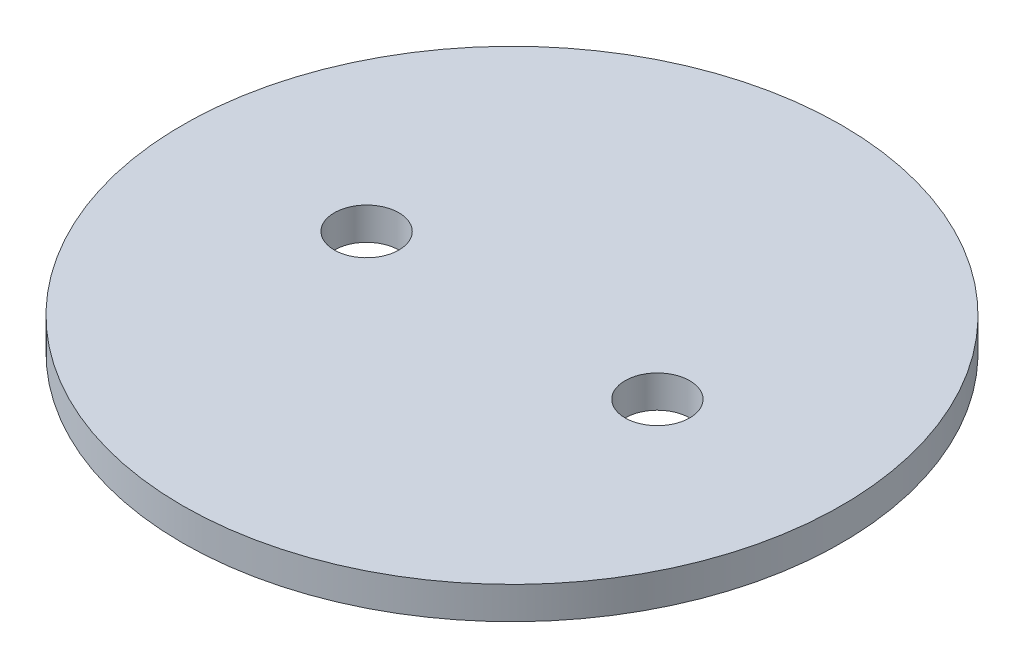
from build123d import *

# Parameters (mm, degrees)
SKETCH_1_R      = 102
SKETCH_1_R_2    = 10
EXTRUDE_1_DEPTH = 10


with BuildPart() as part:
    # Эскиз1 → Бобышка-Вытянуть1 (new body)
    with BuildSketch(Plane(origin=(0, 0, 0), x_dir=(1, 0, 0), z_dir=(0, 1, 0))):
        with Locations(Location((0, 0, 0), (0, 0, 270))):
            Circle(SKETCH_1_R)
        with Locations(Location((-45, 0, 0), (0, 0, 270))):
            Circle(SKETCH_1_R_2, mode=Mode.SUBTRACT)
        with Locations(Location((45, 0, 0), (0, 0, 270))):
            Circle(SKETCH_1_R_2, mode=Mode.SUBTRACT)
    extrude(amount=EXTRUDE_1_DEPTH)


solid = part.part
